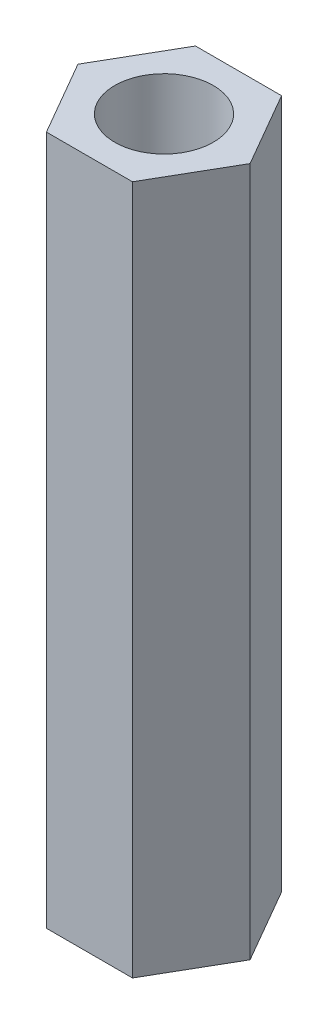
from build123d import *

# Parameters (mm, degrees)
SKETCH_1_R      = 1.5
EXTRUDE_1_DEPTH = 21


with BuildPart() as part:
    # 草图1 → 凸台-拉伸1 (new body)
    with BuildSketch(Plane(origin=(0, 0, 0), x_dir=(1, 0, 0), z_dir=(0, 1, 0))):
        Polygon((2.621170222, 0), (1.310585111, 2.27), (-1.310585111, 2.27), (-2.621170222, 0), (-1.310585111, -2.27), (1.310585111, -2.27), align=None)
        with Locations(Location((0, 0, 0), (0, 0, 90))):
            Circle(SKETCH_1_R, mode=Mode.SUBTRACT)
    extrude(amount=EXTRUDE_1_DEPTH)


solid = part.part
